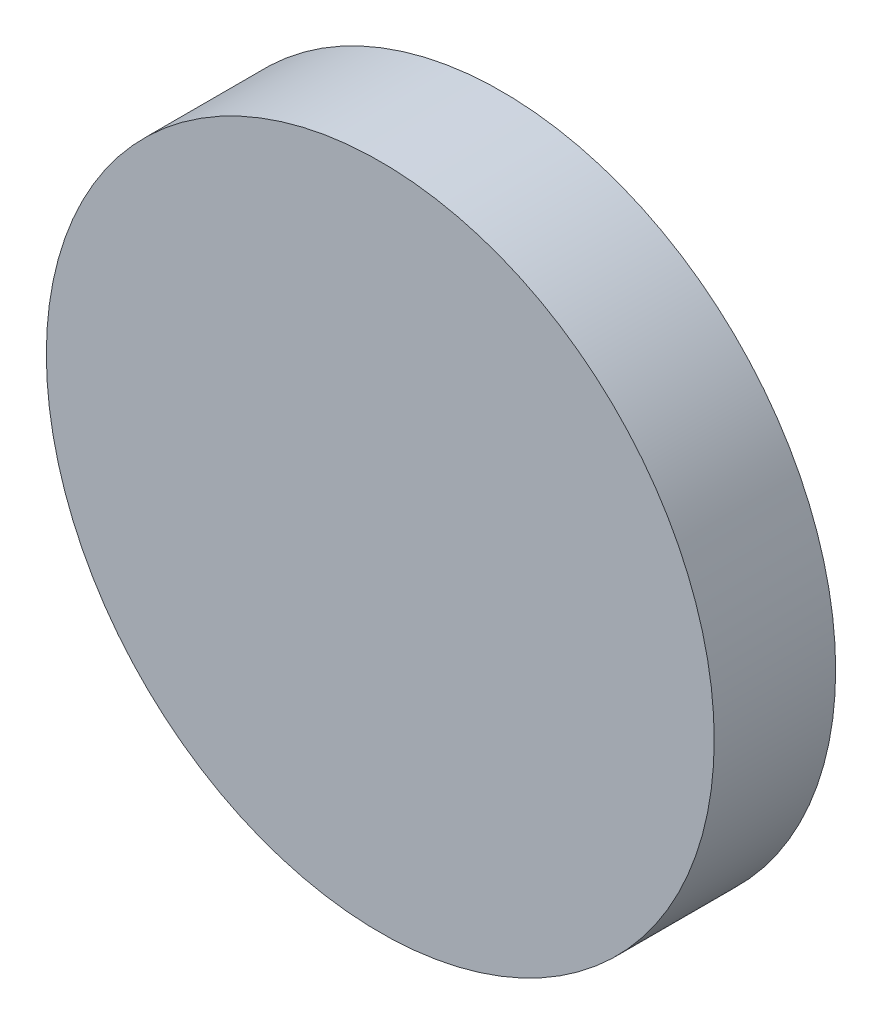
from build123d import *

# Parameters (mm, degrees)
SKETCH1_R           = 209.55
BOSS_EXTRUDE1_DEPTH = 76.2


with BuildPart() as part:
    # Sketch1 → Boss-Extrude1 (new body)
    with BuildSketch(Plane.XY):
        with Locations(Location((0, 0, 0), (0, 0, 180))):
            Circle(SKETCH1_R)
    extrude(amount=BOSS_EXTRUDE1_DEPTH)


solid = part.part
